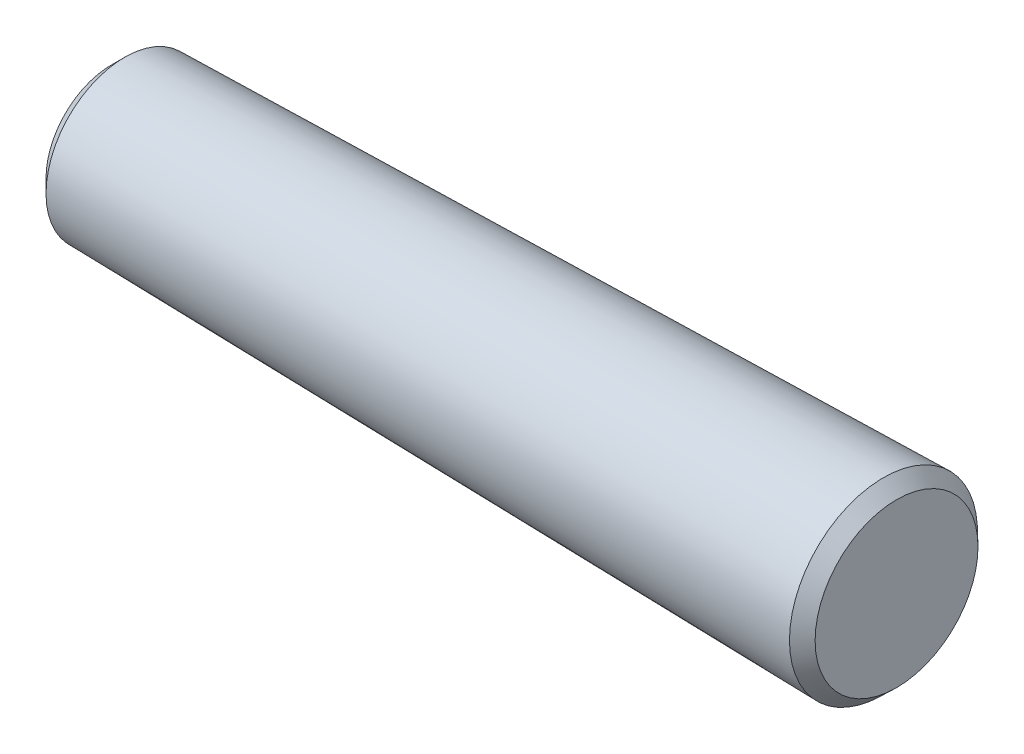
from build123d import *
from OCP.BRepFilletAPI import BRepFilletAPI_MakeChamfer

# Parameters (mm, degrees)
SKETCH_1_W        = 30
SKETCH_1_H        = 3
DRAFT_1_ANGLE     = 1.15
CHAMFER_1_SIZE    = 0.5
CHAMFER_1_SIZE2   = 0.490259275
CHAMFER_1_SIZE2_2 = 0.510345395


with BuildPart() as part:
    # 草图1 → 旋转1 (revolve)
    with BuildSketch(Plane.XY, mode=Mode.PRIVATE) as revolve_1_sk:
        with Locations((15, 1.5)):
            Rectangle(SKETCH_1_W, SKETCH_1_H)
    revolve(revolve_1_sk.sketch.rotate(Axis((30, 0, 0), (-1, 0, 0)), 90), axis=Axis((30, 0, 0), (-1, 0, 0)))

    # 拔模1
    draft_1_faces = [part.faces().sort_by_distance(p)[0] for p in [
        (15, 0, 3),
    ]]
    draft(draft_1_faces, Plane(origin=(0, 0, 0), x_dir=(0, 0, -1), z_dir=(-1, 0, 0)), DRAFT_1_ANGLE)

    # 倒角1: one chamfer whose edges measure the first distance from different faces: ONE call of the kernel's chamfer builder (chamfer() names one face for all edges)
    chamfer_1_edges_1 = [part.edges().sort_by_distance(p)[0] for p in [
        (30, 0, 3.602219463),
    ]]
    chamfer_1_side_1 = [part.faces().sort_by_distance(p)[0] for p in [
        (15, 0, 3.301109732),
    ]]
    chamfer_1_edges_2 = [part.edges().sort_by_distance(p)[0] for p in [
        (0, 0, 3),
    ]]
    chamfer_1_side_2 = [part.faces().sort_by_distance(p)[0] for p in [
        (0, 0, 0),
    ]]
    chamfer_1 = BRepFilletAPI_MakeChamfer(part.part.solid().wrapped)
    for e in chamfer_1_edges_1:
        chamfer_1.Add(CHAMFER_1_SIZE, CHAMFER_1_SIZE2, e.wrapped, chamfer_1_side_1[0].wrapped)  # the first distance lies on this face
    for e in chamfer_1_edges_2:
        chamfer_1.Add(CHAMFER_1_SIZE, CHAMFER_1_SIZE2_2, e.wrapped, chamfer_1_side_2[0].wrapped)  # the first distance lies on this face
    add(Compound.cast(chamfer_1.Shape()), mode=Mode.REPLACE)


solid = part.part
